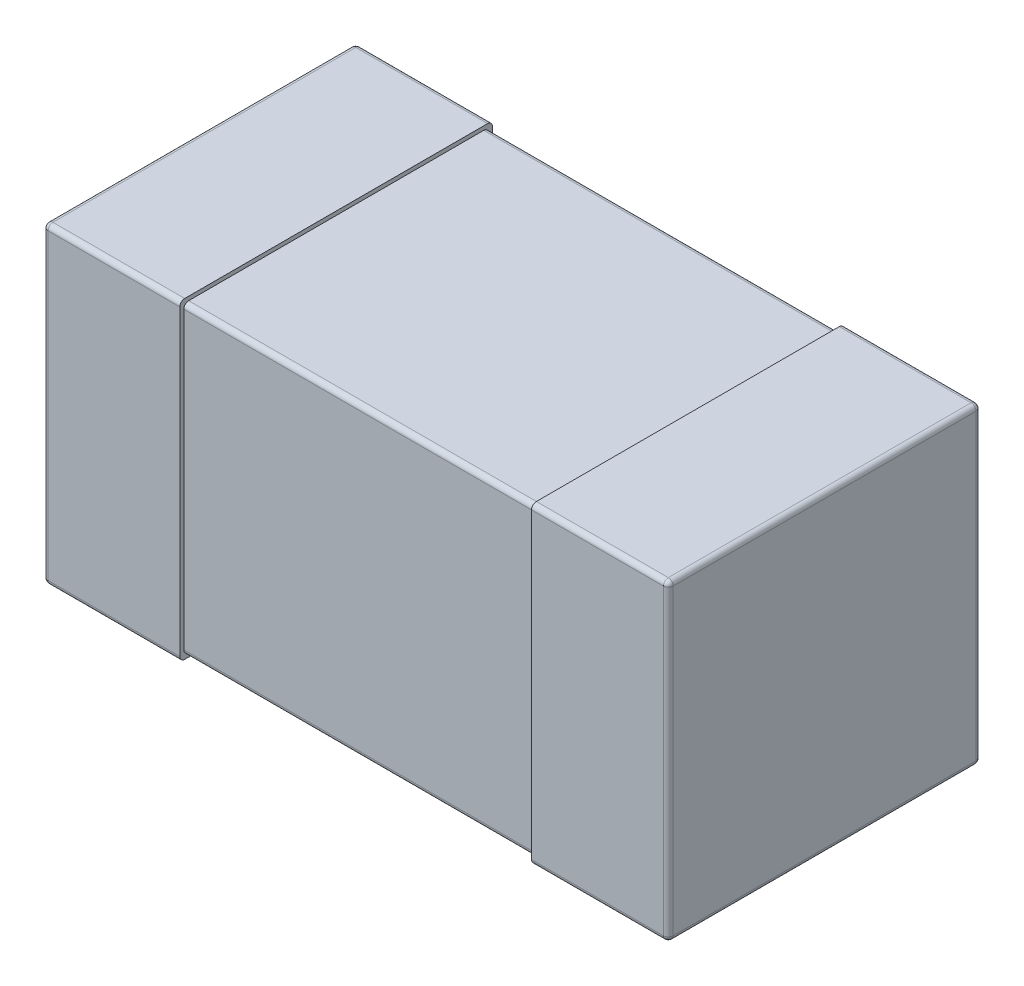
from build123d import *

# Parameters (mm, degrees)
SKETCH_3_W        = 0.7
SKETCH_3_H        = 1.6
EXTRUDE_3_DEPTH   = 1.6
EXTRUDE_3_2_DEPTH = 1.6
EXTRUDE_START     = 0.02
SKETCH_4_W        = 1.8
SKETCH_4_H        = 1.56
EXTRUDE_3_3_DEPTH = 1.56
FILLET_2_R        = 0.025
FILLET_3_R        = 0.025


with BuildPart() as part:
    # Эскиз3 → Extrude 3 (new body)
    with BuildSketch(Plane.XY):
        with Locations((1.25, 0)):
            Rectangle(SKETCH_3_W, SKETCH_3_H)
    extrude(amount=EXTRUDE_3_DEPTH)



with BuildPart() as body_2:
    # Эскиз3 → Extrude 3 2 (new body)
    with BuildSketch(Plane.XY):
        with Locations((-1.25, 0)):
            Rectangle(SKETCH_3_W, SKETCH_3_H)
    extrude(amount=EXTRUDE_3_2_DEPTH)


with BuildPart() as part_1:
    add(part.part)

    add(body_2.part)  # Extrude 3 3 merges body 2
    # Эскиз4 → Extrude 3 3 (add)
    with BuildSketch(Plane.XY.offset(EXTRUDE_START)):
        Rectangle(SKETCH_4_W, SKETCH_4_H)
    extrude(amount=EXTRUDE_3_3_DEPTH)

    # Скругление2
    fillet_2_edges = [part_1.edges().sort_by_distance(p)[0] for p in [
        (-1.6, 0, 1.6),
        (-1.25, -0.8, 1.6),
        (1.25, 0.8, 0),
        (1.6, 0.8, 0.8),
        (1.25, -0.8, 0),
        (1.6, 0, 0),
        (1.6, -0.8, 0.8),
        (1.25, 0.8, 1.6),
        (1.25, -0.8, 1.6),
        (1.6, 0, 1.6),
        (-1.25, -0.8, 0),
        (-1.6, 0, 0),
        (-1.25, 0.8, 0),
        (-1.25, 0.8, 1.6),
        (-1.6, -0.8, 0.8),
        (-1.6, 0.8, 0.8),
    ]]
    fillet(fillet_2_edges, radius=FILLET_2_R)

    # Скругление3
    fillet_3_edges = [part_1.edges().sort_by_distance(p)[0] for p in [
        (0, -0.78, 0.02),
        (0, 0.78, 0.02),
        (0, 0.78, 1.58),
        (0, -0.78, 1.58),
    ]]
    fillet(fillet_3_edges, radius=FILLET_3_R)


solid = part_1.part
